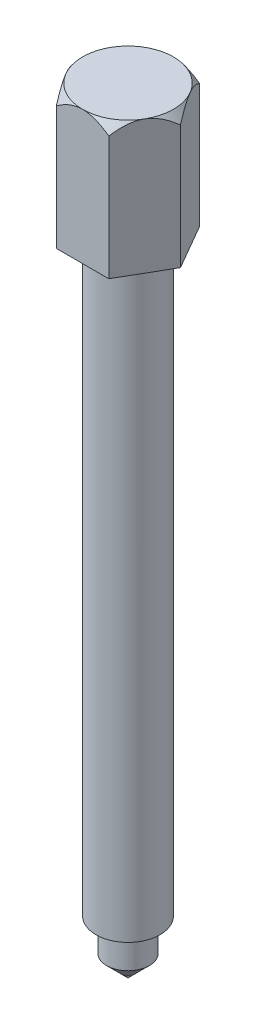
from build123d import *

# Parameters (mm, degrees)
BOSS_EXTRUDE1_DEPTH = 25
SKETCH2_OUTSIDE_W   = 63.85
SKETCH2_OUTSIDE_H   = 61.22
SKETCH2_OUTSIDE_R   = 8.5
CUT_EXTRUDE1_DEPTH  = 25
CUT_EXTRUDE1_DRAFT  = -35
SKETCH3_R           = 6
BOSS_EXTRUDE2_DEPTH = 110
SKETCH4_R           = 4
BOSS_EXTRUDE3_DEPTH = 6


with BuildPart() as part:
    # Sketch1 → Boss-Extrude1 (new body)
    with BuildSketch(Plane(origin=(0, 0, 0), x_dir=(1, 0, 0), z_dir=(0, 1, 0))):
        Polygon((9.814954576, 0), (4.907477288, 8.5), (-4.907477288, 8.5), (-9.814954576, 0), (-4.907477288, -8.5), (4.907477288, -8.5), align=None)
    extrude(amount=-BOSS_EXTRUDE1_DEPTH)


with BuildPart() as cut_extrude1_tool:
    # Sketch2 outside → Cut-Extrude1 (with draft: the straight prism first)
    with BuildSketch(Plane(origin=(0, 0, 0), x_dir=(1, 0, 0), z_dir=(0, 1, 0))):
        Rectangle(SKETCH2_OUTSIDE_W, SKETCH2_OUTSIDE_H)
        Circle(SKETCH2_OUTSIDE_R, mode=Mode.SUBTRACT)
    extrude(amount=-CUT_EXTRUDE1_DEPTH)
    # Cut-Extrude1: the draft: its side faces are tilted about the plane it starts from
    cut_extrude1_sides = [cut_extrude1_tool.faces().sort_by_distance(p)[0] for p in [
        (0, -12.5, 30.61),
        (31.925, -12.5, 0),
        (0, -12.5, -30.61),
        (-31.925, -12.5, 0),
        (-8.5, -12.5, 0),
    ]]
    draft(cut_extrude1_sides, Plane(origin=(0, 0, 0), x_dir=(1, 0, 0), z_dir=(0, 1, 0)), CUT_EXTRUDE1_DRAFT)


with BuildPart() as part_1:
    add(part.part)

    # Cut-Extrude1: cut by cut_extrude1_tool
    add(cut_extrude1_tool.part, mode=Mode.SUBTRACT)

    # Sketch3 → Boss-Extrude2 (add)
    with BuildSketch(Plane.XZ.offset(25)):
        with Locations(Location((0, 0, 0), (0, 0, 90))):
            Circle(SKETCH3_R)
    extrude(amount=BOSS_EXTRUDE2_DEPTH)

    # Sketch4 → Boss-Extrude3 (add)
    with BuildSketch(Plane.XZ.offset(135)):
        with Locations(Location((0, 0, 0), (0, 0, 270))):
            Circle(SKETCH4_R)
    extrude(amount=BOSS_EXTRUDE3_DEPTH)

    # Boss-Extrude4 cone 1 section (through the dimple's axis) → Boss-Extrude4 (revolve)
    with BuildSketch(Plane(origin=(0, -141, 0), x_dir=(0, 0, 1), z_dir=(1, 0, 0))):
        Polygon((0, 0), (4, 0), (0, 4), align=None)
    revolve(axis=Axis((0, -141, 0), (0, -1, 0)))


solid = part_1.part
